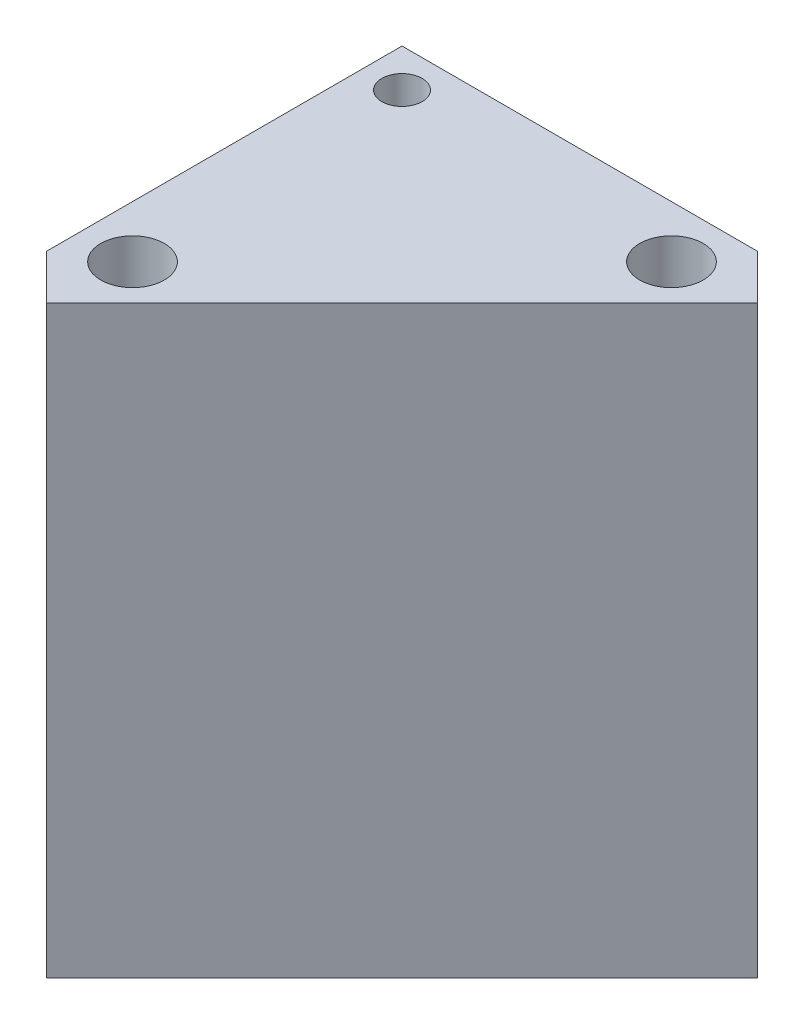
from build123d import *

# Parameters (mm, degrees)
BOSS_EXTRUDE1_DEPTH = 46
CUT_EXTRUDE3_START  = -16
CUT_EXTRUDE3_DEPTH  = 25
SKETCH3_R           = 1.5875
CUT_EXTRUDE4_DEPTH  = 65.070116259
SKETCH5_R           = 2.5
CUT_EXTRUDE5_DEPTH  = 10


with BuildPart() as part:
    # Sketch1 → Boss-Extrude1 (new body)
    with BuildSketch(Plane(origin=(0, 0, 0), x_dir=(1, 0, 0), z_dir=(0, 1, 0))):
        Polygon((0, 0), (0, -28), (3.535533906, -31.535533906), (31.535533906, -3.535533906), (28, 0), align=None)
    extrude(amount=BOSS_EXTRUDE1_DEPTH)

    # Sketch2 → Cut-Extrude3 (cut)
    with BuildSketch(Plane.XZ.offset(CUT_EXTRUDE3_START)):
        with BuildLine():
            Line((0, 20), (0, 0))
            Line((0, 0), (20, 0))
            ThreePointArc((20, 0), (14.142135624, 14.142135624), (0, 20))
        make_face()
    extrude(amount=-CUT_EXTRUDE3_DEPTH, mode=Mode.SUBTRACT)

    # Sketch3 → Cut-Extrude4 (cut, through all)
    with BuildSketch(Plane(origin=(0, 46, 0), x_dir=(1, 0, 0), z_dir=(0, 1, 0))):
        with Locations(Location((3, -3, 0), (0, 0, 270))):
            Circle(SKETCH3_R)
    extrude(amount=-CUT_EXTRUDE4_DEPTH, mode=Mode.SUBTRACT)

    # Sketch5 → Cut-Extrude5 (cut)
    with BuildSketch(Plane(origin=(0, 46, 0), x_dir=(1, 0, 0), z_dir=(0, 1, 0))):
        with Locations(Location((25.313708499, -4.100505063, 0), (0, 0, 270))):
            Circle(SKETCH5_R)
        with Locations(Location((4.100505063, -25.313708499, 0), (0, 0, 90))):
            Circle(SKETCH5_R)
    extrude(amount=-CUT_EXTRUDE5_DEPTH, mode=Mode.SUBTRACT)


solid = part.part
